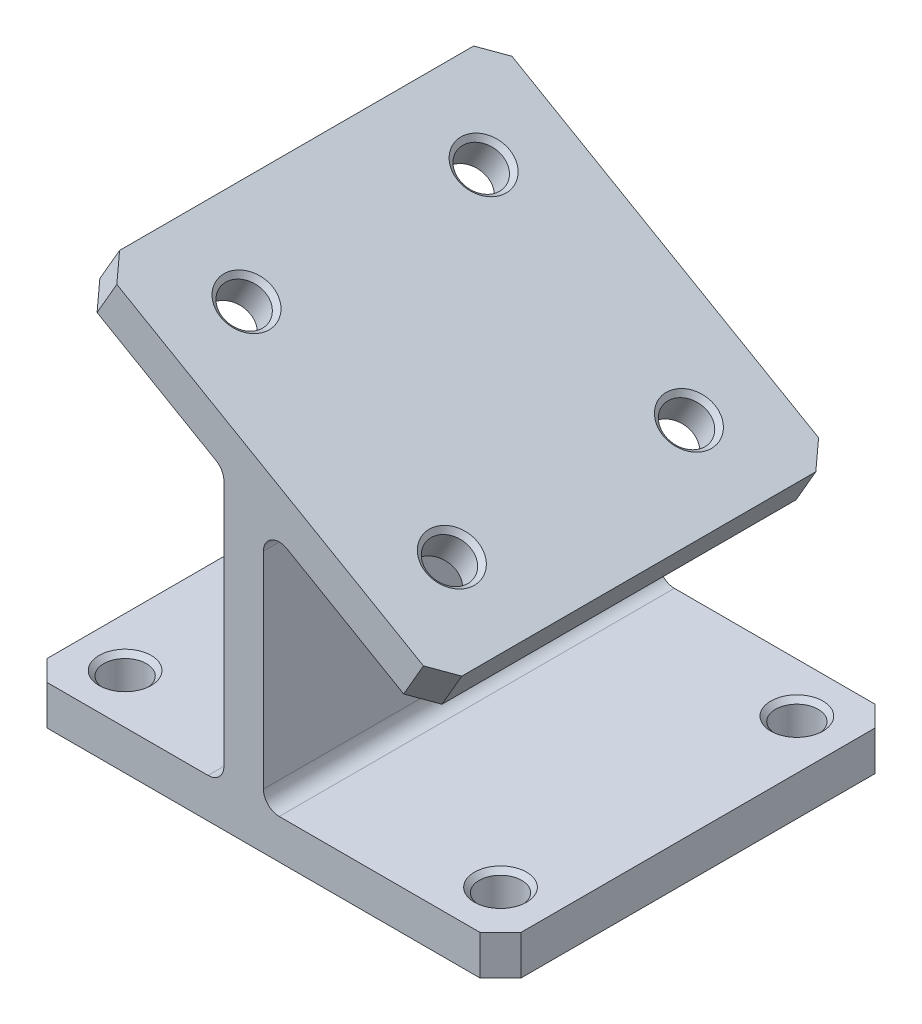
from build123d import *

# Parameters (mm, degrees)
BOSS_EXTRUDE1_DEPTH = 31.75
CHAMFER1_SIZE       = 3.302
CUT_EXTRUDE1_REACH  = 78.827
SKETCH2_R           = 3.429
CUT_EXTRUDE2_REACH  = 90.004
SKETCH3_R           = 3.429
CHAMFER2_SIZE       = 0.762


with BuildPart() as part:
    # Sketch1 → Boss-Extrude1 (new, symmetric)
    with BuildSketch(Plane.XY):
        with BuildLine():
            Line((0, 2.54), (0, 42.264401363))
            ThreePointArc((0, 42.264401363), (-0.340295474, 43.534401363), (-1.27, 44.464105889))
            Line((-1.27, 44.464105889), (-23.24261314, 57.15))
            Line((-23.24261314, 57.15), (-20.06761314, 62.649261314))
            Line((-20.06761314, 62.649261314), (34.925, 30.899261314))
            Line((34.925, 30.899261314), (31.75, 25.4))
            Line((31.75, 25.4), (10.16, 37.864992312))
            ThreePointArc((10.16, 37.864992312), (7.62, 37.864992312), (6.35, 35.665287786))
            Line((6.35, 35.665287786), (6.35, 2.54))
            ThreePointArc((6.35, 2.54), (7.093948776, 0.743948776), (8.89, 0))
            Line((8.89, 0), (44.45, 0))
            Line((44.45, 0), (44.45, -6.35))
            Line((44.45, -6.35), (-31.75, -6.35))
            Line((-31.75, -6.35), (-31.75, 0))
            Line((-31.75, 0), (-2.54, 0))
            ThreePointArc((-2.54, 0), (-0.743948776, 0.743948776), (0, 2.54))
        make_face()
    extrude(amount=BOSS_EXTRUDE1_DEPTH, both=True)

    # Chamfer1
    chamfer1_edges = [part.edges().sort_by_distance(p)[0] for p in [
        (33.3375, 28.149630657, -31.75),
        (44.45, -3.175, -31.75),
        (-31.75, -3.175, -31.75),
        (-21.65511314, 59.899630657, -31.75),
        (-31.75, -3.175, 31.75),
        (44.45, -3.175, 31.75),
        (-21.65511314, 59.899630657, 31.75),
        (33.3375, 28.149630657, 31.75),
    ]]
    chamfer(chamfer1_edges, length=CHAMFER1_SIZE)

    # Sketch2 → Cut-Extrude1 (cut, up to next)
    with BuildSketch(Plane(origin=(22.111022628, 38.297414599, 0), x_dir=(0.8660254037844416, -0.499999999999995, 0), z_dir=(0.49999999999999495, 0.8660254037844415, 0)), mode=Mode.PRIVATE) as cut_extrude1_sk1:
        with Locations(Location((-36.00369343, 19.05, 0), (0, 0, 180))):
            Circle(SKETCH2_R)
    cut_extrude1_tool1 = extrude(cut_extrude1_sk1.sketch, amount=-CUT_EXTRUDE1_REACH, mode=Mode.PRIVATE) & part.part
    # Sketch2 → Cut-Extrude1 (cut, up to next)
    with BuildSketch(Plane(origin=(22.111022628, 38.297414599, 0), x_dir=(0.8660254037844416, -0.499999999999995, 0), z_dir=(0.49999999999999495, 0.8660254037844415, 0)), mode=Mode.PRIVATE) as cut_extrude1_sk2:
        with Locations(Location((2.09630657, 19.05, 0), (0, 0, 180))):
            Circle(SKETCH2_R)
    cut_extrude1_tool2 = extrude(cut_extrude1_sk2.sketch, amount=-CUT_EXTRUDE1_REACH, mode=Mode.PRIVATE) & part.part
    # Sketch2 → Cut-Extrude1 (cut, up to next)
    with BuildSketch(Plane(origin=(22.111022628, 38.297414599, 0), x_dir=(0.8660254037844416, -0.499999999999995, 0), z_dir=(0.49999999999999495, 0.8660254037844415, 0)), mode=Mode.PRIVATE) as cut_extrude1_sk3:
        with Locations(Location((-36.00369343, -19.05, 0), (0, 0, 180))):
            Circle(SKETCH2_R)
    cut_extrude1_tool3 = extrude(cut_extrude1_sk3.sketch, amount=-CUT_EXTRUDE1_REACH, mode=Mode.PRIVATE) & part.part
    # Sketch2 → Cut-Extrude1 (cut, up to next)
    with BuildSketch(Plane(origin=(22.111022628, 38.297414599, 0), x_dir=(0.8660254037844416, -0.499999999999995, 0), z_dir=(0.49999999999999495, 0.8660254037844415, 0)), mode=Mode.PRIVATE) as cut_extrude1_sk4:
        with Locations(Location((2.09630657, -19.05, 0), (0, 0, 180))):
            Circle(SKETCH2_R)
    cut_extrude1_tool4 = extrude(cut_extrude1_sk4.sketch, amount=-CUT_EXTRUDE1_REACH, mode=Mode.PRIVATE) & part.part
    add(cut_extrude1_tool1.solids().sort_by_distance((-9.069091, 56.299261, -19.05))[0], mode=Mode.SUBTRACT)
    add(cut_extrude1_tool2.solids().sort_by_distance((23.926477, 37.249261, -19.05))[0], mode=Mode.SUBTRACT)
    add(cut_extrude1_tool3.solids().sort_by_distance((-9.069091, 56.299261, 19.05))[0], mode=Mode.SUBTRACT)
    add(cut_extrude1_tool4.solids().sort_by_distance((23.926477, 37.249261, 19.05))[0], mode=Mode.SUBTRACT)

    # Sketch3 → Cut-Extrude2 (cut, up to next)
    with BuildSketch(Plane.XZ.offset(6.35), mode=Mode.PRIVATE) as cut_extrude2_sk1:
        with Locations((-23.8125, 23.8125)):
            Circle(SKETCH3_R)
    cut_extrude2_tool1 = extrude(cut_extrude2_sk1.sketch, amount=-CUT_EXTRUDE2_REACH, mode=Mode.PRIVATE) & part.part
    # Sketch3 → Cut-Extrude2 (cut, up to next)
    with BuildSketch(Plane.XZ.offset(6.35), mode=Mode.PRIVATE) as cut_extrude2_sk2:
        with Locations((36.5125, 23.8125)):
            Circle(SKETCH3_R)
    cut_extrude2_tool2 = extrude(cut_extrude2_sk2.sketch, amount=-CUT_EXTRUDE2_REACH, mode=Mode.PRIVATE) & part.part
    # Sketch3 → Cut-Extrude2 (cut, up to next)
    with BuildSketch(Plane.XZ.offset(6.35), mode=Mode.PRIVATE) as cut_extrude2_sk3:
        with Locations((-23.8125, -23.8125)):
            Circle(SKETCH3_R)
    cut_extrude2_tool3 = extrude(cut_extrude2_sk3.sketch, amount=-CUT_EXTRUDE2_REACH, mode=Mode.PRIVATE) & part.part
    # Sketch3 → Cut-Extrude2 (cut, up to next)
    with BuildSketch(Plane.XZ.offset(6.35), mode=Mode.PRIVATE) as cut_extrude2_sk4:
        with Locations((36.5125, -23.8125)):
            Circle(SKETCH3_R)
    cut_extrude2_tool4 = extrude(cut_extrude2_sk4.sketch, amount=-CUT_EXTRUDE2_REACH, mode=Mode.PRIVATE) & part.part
    add(cut_extrude2_tool1.solids().sort_by_distance((-23.8125, -6.35, 23.8125))[0], mode=Mode.SUBTRACT)
    add(cut_extrude2_tool2.solids().sort_by_distance((36.5125, -6.35, 23.8125))[0], mode=Mode.SUBTRACT)
    add(cut_extrude2_tool3.solids().sort_by_distance((-23.8125, -6.35, -23.8125))[0], mode=Mode.SUBTRACT)
    add(cut_extrude2_tool4.solids().sort_by_distance((36.5125, -6.35, -23.8125))[0], mode=Mode.SUBTRACT)

    # Chamfer2
    chamfer2_edges = [part.edges().sort_by_distance(p)[0] for p in [
        (23.721078482, 30.0355, -19.05),
        (26.896078482, 35.534761314, -19.05),
        (-6.099489403, 54.584761314, 19.05),
        (-9.274489403, 49.0855, 19.05),
        (23.721078482, 30.0355, 19.05),
        (26.896078482, 35.534761314, 19.05),
        (-6.099489403, 54.584761314, -19.05),
        (-9.274489403, 49.0855, -19.05),
        (33.0835, -6.35, 23.8125),
        (33.0835, 0, 23.8125),
        (-27.2415, -6.35, -23.8125),
        (-27.2415, 0, -23.8125),
        (33.0835, -6.35, -23.8125),
        (33.0835, 0, -23.8125),
        (-27.2415, -6.35, 23.8125),
        (-27.2415, 0, 23.8125),
    ]]
    chamfer(chamfer2_edges, length=CHAMFER2_SIZE)


solid = part.part
